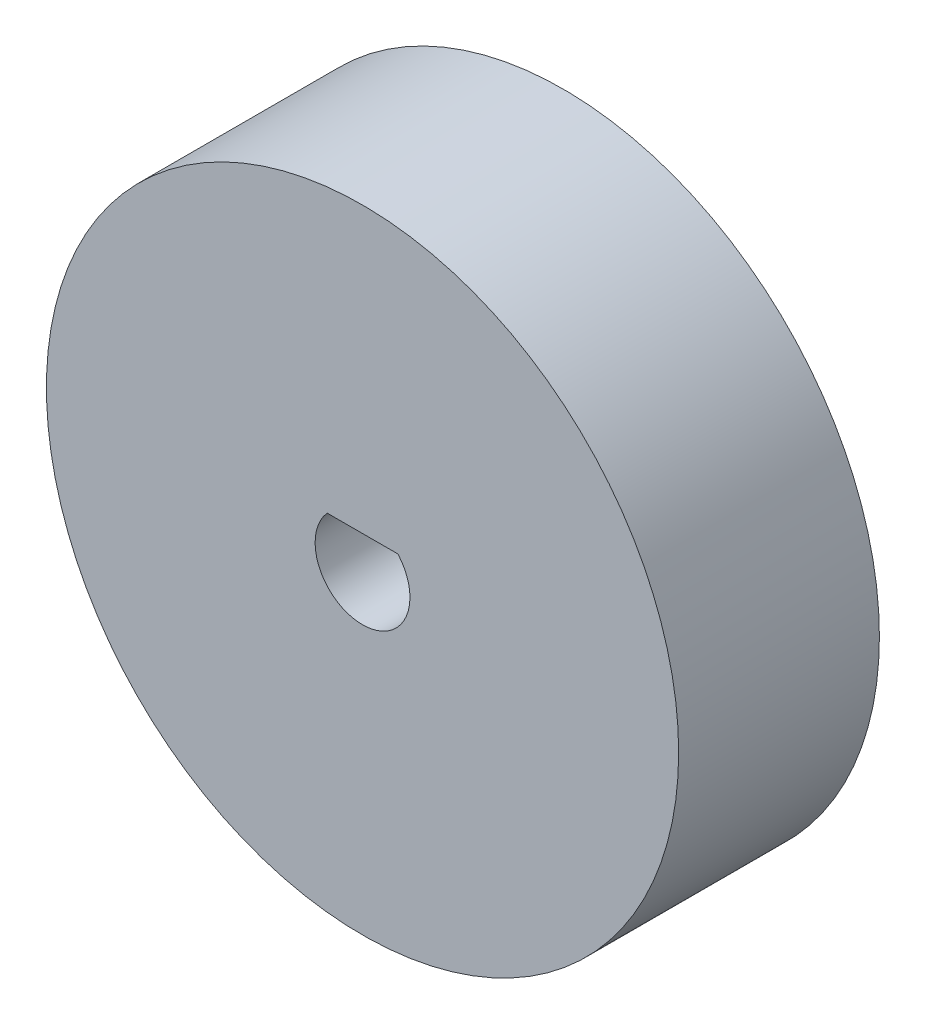
from build123d import *

# Parameters (mm, degrees)
SKETCH1_R               = 9.999999939
BOSS_EXTRUDE1_DEPTH     = 6.35
CUT_EXTRUDE1_DEPTH      = 16.502338455
CUT_EXTRUDE1_DEPTH_BACK = 16.502338455


with BuildPart() as part:
    # Sketch1 → Boss-Extrude1 (new body)
    with BuildSketch(Plane.XY):
        Circle(SKETCH1_R)
    extrude(amount=BOSS_EXTRUDE1_DEPTH)

    # Sketch2 → Cut-Extrude1 (cut, two sides: drawn at the far end of the back side and taken through both)
    with BuildSketch(Plane.XY.offset(6.35).offset(-CUT_EXTRUDE1_DEPTH_BACK)):
        with BuildLine():
            Line((-1.118034025, 1.000000032), (1.118034025, 1.000000032))
            ThreePointArc((1.118034025, 1.000000032), (0, -1.500000048), (-1.118034025, 1.000000032))
        make_face()
    extrude(amount=CUT_EXTRUDE1_DEPTH + CUT_EXTRUDE1_DEPTH_BACK, mode=Mode.SUBTRACT)


solid = part.part
